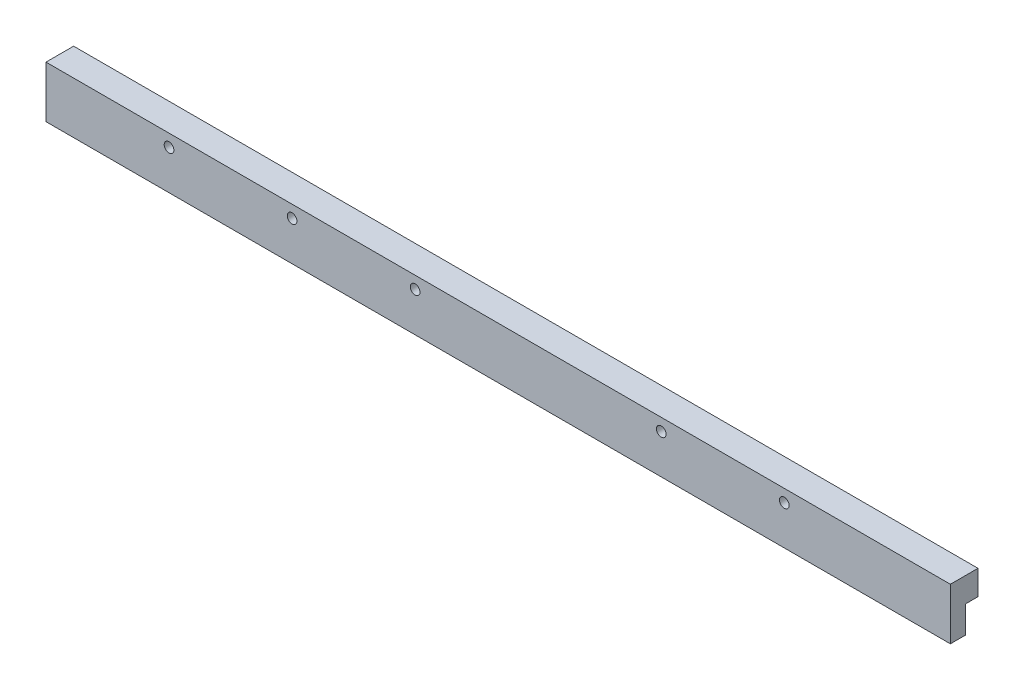
from build123d import *
from build123d.topology import SkipClean

# Parameters (mm, degrees)
BOSS_EXTRUDE1_DEPTH     = 177.8
SKETCH2_R               = 6.35
BOSS_EXTRUDE2_DEPTH     = 3.175
CUT_EXTRUDE1_DEPTH      = 7.62
SKETCH4_R               = 35.56
CUT_EXTRUDE2_DEPTH      = 5.08
BOSS_EXTRUDE3_DEPTH     = 3.175
BOSS_EXTRUDE4_START     = -3.175
BOSS_EXTRUDE4_DEPTH     = 3.175
SKETCH2_3_R             = 6.35
CUT_EXTRUDE3_DEPTH      = 203.2
SKETCH7_W               = 104.303861479
SKETCH7_H               = 17.78
CUT_EXTRUDE4_DEPTH      = 7.62
SKETCH9_W               = 5.09491902
SKETCH9_H               = 10.16
BOSS_EXTRUDE5_DEPTH     = 373.38
SKETCH10_W              = 16.389929124
SKETCH10_H              = 55.852942909
CUT_EXTRUDE5_DEPTH      = 50.8
SKETCH11_W              = 37.311204657
SKETCH11_H              = 70.036499624
CUT_EXTRUDE6_DEPTH      = 63.5
CUT_EXTRUDE_THIN3_DEPTH = 1.27
BOSS_EXTRUDE6_DEPTH     = 1.27
BOSS_EXTRUDE6_2_DEPTH   = 1.27
BOSS_EXTRUDE6_3_DEPTH   = 1.27
BOSS_EXTRUDE6_4_DEPTH   = 1.27
SKETCH14_R              = 6.35
CUT_EXTRUDE7_DEPTH      = 6.35
SKETCH15_R              = 6.35
CUT_EXTRUDE8_DEPTH      = 6.35
SKETCH16_R              = 2
CUT_EXTRUDE9_DEPTH      = 203.2
SKETCH17_R              = 2
CUT_EXTRUDE10_DEPTH     = 50.8
CUT_EXTRUDE11_DEPTH     = 50.8
CUT_EXTRUDE12_DEPTH     = 135.636
SKETCH20_W              = 88.9
SKETCH20_H              = 19.05
CUT_EXTRUDE13_DEPTH     = 25.4
SKETCH22_W              = 88.9
SKETCH22_H              = 19.05
CUT_EXTRUDE14_DEPTH     = 25.4
CUT_EXTRUDE15_DEPTH     = 12.7
SKETCH24_R              = 1.5
CUT_EXTRUDE16_DEPTH     = 12.7
SKETCH25_W              = 262.331886811
SKETCH25_H              = 349.210695903
CUT_EXTRUDE17_DEPTH     = 381


with BuildPart() as part:
    # Sketch1 → Boss-Extrude1 (new body)
    with BuildSketch(Plane.XY):
        Polygon((174.206706958, 205.225588808), (176.700980282, 203.057350086), (6.59291173, 7.37040221), (4.098638405, 9.538640932), align=None)
        Polygon((176.700980282, 203.057350086), (176.700980282, 207.584488047), (174.206706958, 205.225588808), align=None)
        Polygon((176.700980282, 203.057350086), (176.700980282, 207.584488047), (294.86623267, 79.97762329), (292.609334988, 77.887713122), align=None)
        Polygon((176.700980282, 203.057350086), (6.59291173, 7.37040221), (11.706315855, 7.37040221), (176.700980282, 197.43083223), align=None)
        Polygon((292.609334988, 77.887713122), (179.222024463, 200.334870023), (176.700980282, 197.43083223), (289.802992908, 75.306026972), align=None)
        Polygon((179.222024463, 200.334870023), (176.700980282, 203.057350086), (176.700980282, 197.43083223), align=None)
    extrude(amount=BOSS_EXTRUDE1_DEPTH)

    # Sketch2 → Boss-Extrude2 (add)
    with BuildSketch(Plane(origin=(0, 0, 0), x_dir=(-1, 0, 0), z_dir=(0, 0, -1))):
        Polygon((-176.700980282, 207.584488047), (-294.86623267, 79.97762329), (-294.86623267, 308.57762329), (-4.03623267, 308.57762329), (-4.03623267, 9.466851346), align=None)
        with Locations((-109.551832016, 215.6073789)):
            Circle(SKETCH2_R, mode=Mode.SUBTRACT)
        with Locations((-50.099162461, 143.63835786)):
            Circle(SKETCH2_R, mode=Mode.SUBTRACT)
    boss_extrude2 = extrude(amount=-BOSS_EXTRUDE2_DEPTH)

    # Mirror1: Boss-Extrude2 across plane
    add(boss_extrude2.mirror(Plane.XY.offset(88.9)))

    # Sketch3 → Cut-Extrude1 (cut)
    with BuildSketch(Plane(origin=(-2.388376456, 2.076183978, 0), x_dir=(0.6560590289905027, 0.754709580222776, 0), z_dir=(-0.754709580222776, 0.6560590289905027, 0))):
        Polygon((146.938003774, -3.175), (147.021985505, -88.9), (210.43489334, -88.9), (210.43489334, -3.175), align=None)
        Polygon((210.43489334, -88.9), (147.021985505, -88.9), (147.047852426, -115.303859178), (210.43489334, -115.303859178), align=None)
    extrude(amount=-CUT_EXTRUDE1_DEPTH, mode=Mode.SUBTRACT)

    # Sketch4 → Cut-Extrude2 (cut)
    with BuildSketch(Plane.XY.offset(3.175)):
        with Locations((115.138547862, 136.94700246)):
            Circle(SKETCH4_R)
    extrude(amount=-CUT_EXTRUDE2_DEPTH, mode=Mode.SUBTRACT)

    # Sketch5 → Boss-Extrude3 (add)
    with BuildSketch(Plane(origin=(0, 0, 0), x_dir=(-1, 0, 0), z_dir=(0, 0, -1))):
        with BuildLine():
            Line((23.718677813, 87.809342908), (-4.03623267, 87.809342908))
            Line((-4.03623267, 87.809342908), (-4.03623267, 68.97229904))
            ThreePointArc((-4.03623267, 68.97229904), (2.710389506, 69.812621892), (6.35, 64.070123417))
            ThreePointArc((6.35, 64.070123417), (2.710389506, 58.327624943), (-4.03623267, 59.167947795))
            Line((-4.03623267, 59.167947795), (-4.03623267, 41.258157594))
            Line((-4.03623267, 41.258157594), (23.718677813, 41.258157594))
            Line((23.718677813, 41.258157594), (23.718677813, 87.809342908))
        make_face()
    extrude(amount=-BOSS_EXTRUDE3_DEPTH)

    # Sketch6 → Boss-Extrude4 (add)
    with BuildSketch(Plane.XY.offset(177.8).offset(BOSS_EXTRUDE4_START)):
        with BuildLine():
            Line((4.03623267, 68.97229904), (4.03623267, 87.809342908))
            Line((4.03623267, 87.809342908), (-23.718677813, 87.809342908))
            Line((-23.718677813, 87.809342908), (-23.718677813, 41.258157594))
            Line((-23.718677813, 41.258157594), (4.03623267, 41.258157594))
            Line((4.03623267, 41.258157594), (4.03623267, 59.167947795))
            ThreePointArc((4.03623267, 59.167947795), (-6.35, 64.070123417), (4.03623267, 68.97229904))
        make_face()
    extrude(amount=BOSS_EXTRUDE4_DEPTH)

    # Sketch2<3> → Cut-Extrude3 (cut)
    with SkipClean():  # the faces are left unmerged after this step: merging them gives an invalid solid
        with BuildSketch(Plane(origin=(0, 0, 0), x_dir=(-1, 0, 0), z_dir=(0, 0, -1))):
            with Locations((0, 64.070123417)):
                Circle(SKETCH2_3_R)
        extrude(amount=-CUT_EXTRUDE3_DEPTH, mode=Mode.SUBTRACT)

    # Sketch7 → Cut-Extrude4 (cut)
    with SkipClean():  # the faces are left unmerged after this step: merging them gives an invalid solid
        with BuildSketch(Plane(origin=(198.614996443, 183.919503291, 0), x_dir=(0, 0, -1), z_dir=(0.7337298645028701, 0.6794413042615234, 0))):
            with Locations((-88.799310538, -132.772327008)):
                Rectangle(SKETCH7_W, SKETCH7_H)
        extrude(amount=-CUT_EXTRUDE4_DEPTH, mode=Mode.SUBTRACT)

    # Sketch9 → Boss-Extrude5 (add)
    with SkipClean():  # the faces are left unmerged after this step: merging them gives an invalid solid
        with BuildSketch(Plane(origin=(294.86623267, 0, 0), x_dir=(0, 0, -1), z_dir=(1, 0, 0))):
            with Locations((2.54745951, 191.791667894)):
                Rectangle(SKETCH9_W, SKETCH9_H)
            Polygon((5.09491902, 196.871667894), (5.09491902, 186.711667894), (5.09491902, 175.560674011), (11.405822058, 175.560674011), (11.405822058, 196.871667894), align=None)
        boss_extrude5 = extrude(amount=-BOSS_EXTRUDE5_DEPTH)

    # Mirror2: Boss-Extrude5 across plane
    with SkipClean():  # the faces are left unmerged after this step: merging them gives an invalid solid
        add(boss_extrude5.mirror(Plane.XY.offset(88.9)))

    # Sketch10 → Cut-Extrude5 (cut)
    with SkipClean():  # the faces are left unmerged after this step: merging them gives an invalid solid
        with BuildSketch(Plane(origin=(294.86623267, 0, 0), x_dir=(0, 0, -1), z_dir=(1, 0, 0))):
            with Locations((8.194964562, 177.809205996)):
                Rectangle(SKETCH10_W, SKETCH10_H)
        extrude(amount=-CUT_EXTRUDE5_DEPTH, mode=Mode.SUBTRACT)

    # Sketch11 → Cut-Extrude6 (cut)
    with SkipClean():  # the faces are left unmerged after this step: merging them gives an invalid solid
        with BuildSketch(Plane(origin=(0, 0, 0), x_dir=(-1, 0, 0), z_dir=(0, 0, -1))):
            with Locations((-276.210630342, 174.143668429)):
                Rectangle(SKETCH11_W, SKETCH11_H)
        extrude(amount=-CUT_EXTRUDE6_DEPTH, mode=Mode.SUBTRACT)

    # Sketch12 → Cut-Extrude-Thin3 (cut)
    with SkipClean():  # the faces are left unmerged after this step: merging them gives an invalid solid
        with BuildSketch(Plane(origin=(198.614996443, 183.919503291, 0), x_dir=(0, 0, -1), z_dir=(0.7337298645028701, 0.6794413042615234, 0))):
            Polygon((-171.532951818, 28.022585612), (-143.20199229, -115.162103868), (-139.962790584, -114.521185535), (-168.293750113, 28.663503944), align=None)
            Polygon((-33.454545449, -115.162103868), (-6.228065693, 28.022585612), (-9.471942339, 28.639406741), (-36.698422095, -114.545282739), align=None)
        extrude(amount=-CUT_EXTRUDE_THIN3_DEPTH, mode=Mode.SUBTRACT)

    # Sketch14 → Cut-Extrude7 (cut)
    with SkipClean():  # the faces are left unmerged after this step: merging them gives an invalid solid
        with BuildSketch(Plane.XY.offset(3.175)):
            with Locations((25.62623267, 167.726388192)):
                Circle(SKETCH14_R)
        extrude(amount=-CUT_EXTRUDE7_DEPTH, mode=Mode.SUBTRACT)

    # Sketch15 → Cut-Extrude8 (cut)
    with SkipClean():  # the faces are left unmerged after this step: merging them gives an invalid solid
        with BuildSketch(Plane.XY.offset(177.8)):
            with Locations((25.62623267, 167.726388192)):
                Circle(SKETCH15_R)
        extrude(amount=-CUT_EXTRUDE8_DEPTH, mode=Mode.SUBTRACT)

    # Sketch16 → Cut-Extrude9 (cut)
    with SkipClean():  # the faces are left unmerged after this step: merging them gives an invalid solid
        with BuildSketch(Plane(origin=(0, 0, -11.405822058), x_dir=(-1, 0, 0), z_dir=(0, 0, -1))):
            with Locations(Location((-175.48623267, 191.791667894, 0), (0, 0, 90))):
                Circle(SKETCH16_R)
            with Locations(Location((-73.88623267, 191.791667894, 0), (0, 0, 180))):
                Circle(SKETCH16_R)
            with Locations(Location((-23.08623267, 191.791667894, 0), (0, 0, 180))):
                Circle(SKETCH16_R)
            with Locations(Location((27.71376733, 191.791667894, 0), (0, 0, 90))):
                Circle(SKETCH16_R)
        extrude(amount=-CUT_EXTRUDE9_DEPTH, mode=Mode.SUBTRACT)

    # Sketch17 → Cut-Extrude10 (cut)
    with SkipClean():  # the faces are left unmerged after this step: merging them gives an invalid solid
        with BuildSketch(Plane.XY.offset(189.205822058)):
            with Locations((226.28623267, 191.73762329)):
                Circle(SKETCH17_R)
        extrude(amount=-CUT_EXTRUDE10_DEPTH, mode=Mode.SUBTRACT)

    # Sketch18 → Cut-Extrude11 (cut)
    with SkipClean():  # the faces are left unmerged after this step: merging them gives an invalid solid
        with BuildSketch(Plane(origin=(198.614996443, 183.919503291, 0), x_dir=(0, 0, -1), z_dir=(0.7337298645028701, 0.6794413042615234, 0))):
            Polygon((-170.82495725, -33.509501551), (-170.82495725, -115.912858784), (-148.021512482, -115.912858784), (-165.124096058, -33.509501551), align=None)
        extrude(amount=-CUT_EXTRUDE11_DEPTH, mode=Mode.SUBTRACT)

    # Sketch19 → Cut-Extrude12 (cut)
    with SkipClean():  # the faces are left unmerged after this step: merging them gives an invalid solid
        with BuildSketch(Plane(origin=(198.614996443, 183.919503291, 0), x_dir=(0, 0, -1), z_dir=(0.7337298645028701, 0.6794413042615234, 0))):
            Polygon((-27.790980507, -115.912858784), (-12.83560064, -35.35545082), (-7.206169917, -35.35545082), (-7.206169917, -115.912858784), align=None)
        extrude(amount=-CUT_EXTRUDE12_DEPTH, mode=Mode.SUBTRACT)

    # Sketch20 → Cut-Extrude13 (cut)
    with SkipClean():  # the faces are left unmerged after this step: merging them gives an invalid solid
        with BuildSketch(Plane.XY.offset(177.8)):
            with BuildLine():
                Line((162.857920191, 291.02562329), (162.857920191, 292.57562329))
                Line((162.857920191, 292.57562329), (164.407920191, 292.57562329))
                ThreePointArc((164.407920191, 292.57562329), (161.76190468, 293.671638801), (162.857920191, 291.02562329))
            make_face()
            with BuildLine():
                Line((164.407920191, 292.57562329), (162.857920191, 292.57562329))
                Line((162.857920191, 292.57562329), (162.857920191, 291.02562329))
                ThreePointArc((162.857920191, 291.02562329), (163.953935702, 291.479607779), (164.407920191, 292.57562329))
            make_face()
            with BuildLine():
                ThreePointArc((266.007920191, 292.57562329), (264.457920191, 294.12562329), (262.907920191, 292.57562329))
                Line((262.907920191, 292.57562329), (264.457920191, 292.57562329))
                Line((264.457920191, 292.57562329), (264.457920191, 291.02562329))
                ThreePointArc((264.457920191, 291.02562329), (265.553935702, 291.479607779), (266.007920191, 292.57562329))
            make_face()
            with BuildLine():
                Line((264.457920191, 292.57562329), (262.907920191, 292.57562329))
                ThreePointArc((262.907920191, 292.57562329), (263.36190468, 291.479607779), (264.457920191, 291.02562329))
                Line((264.457920191, 291.02562329), (264.457920191, 292.57562329))
            make_face()
            with BuildLine():
                ThreePointArc((164.407920191, 241.77562329), (163.953935702, 242.871638801), (162.857920191, 243.32562329))
                Line((162.857920191, 243.32562329), (162.857920191, 241.77562329))
                Line((162.857920191, 241.77562329), (164.407920191, 241.77562329))
            make_face()
            with BuildLine():
                Line((162.857920191, 241.77562329), (162.857920191, 243.32562329))
                ThreePointArc((162.857920191, 243.32562329), (161.76190468, 240.679607779), (164.407920191, 241.77562329))
                Line((164.407920191, 241.77562329), (162.857920191, 241.77562329))
            make_face()
            with BuildLine():
                ThreePointArc((266.007920191, 241.77562329), (265.553935702, 242.871638801), (264.457920191, 243.32562329))
                Line((264.457920191, 243.32562329), (264.457920191, 241.77562329))
                Line((264.457920191, 241.77562329), (262.907920191, 241.77562329))
                ThreePointArc((262.907920191, 241.77562329), (264.457920191, 240.22562329), (266.007920191, 241.77562329))
            make_face()
            with BuildLine():
                Line((264.457920191, 241.77562329), (264.457920191, 243.32562329))
                ThreePointArc((264.457920191, 243.32562329), (263.36190468, 242.871638801), (262.907920191, 241.77562329))
                Line((262.907920191, 241.77562329), (264.457920191, 241.77562329))
            make_face()
            with Locations((213.657920191, 282.969686208)):
                Rectangle(SKETCH20_W, SKETCH20_H)
        extrude(amount=-CUT_EXTRUDE13_DEPTH, mode=Mode.SUBTRACT)

    # Sketch22 → Cut-Extrude14 (cut)
    with SkipClean():  # the faces are left unmerged after this step: merging them gives an invalid solid
        with BuildSketch(Plane(origin=(0, 0, 0), x_dir=(-1, 0, 0), z_dir=(0, 0, -1))):
            with BuildLine():
                Line((-264.581570713, 291.02562329), (-264.581570713, 292.57562329))
                Line((-264.581570713, 292.57562329), (-263.031570713, 292.57562329))
                ThreePointArc((-263.031570713, 292.57562329), (-265.677586224, 293.671638801), (-264.581570713, 291.02562329))
            make_face()
            with BuildLine():
                Line((-263.031570713, 292.57562329), (-264.581570713, 292.57562329))
                Line((-264.581570713, 292.57562329), (-264.581570713, 291.02562329))
                ThreePointArc((-264.581570713, 291.02562329), (-263.485555202, 291.479607779), (-263.031570713, 292.57562329))
            make_face()
            with BuildLine():
                ThreePointArc((-263.031570713, 241.77562329), (-263.485555202, 242.871638801), (-264.581570713, 243.32562329))
                Line((-264.581570713, 243.32562329), (-264.581570713, 241.77562329))
                Line((-264.581570713, 241.77562329), (-263.031570713, 241.77562329))
            make_face()
            with BuildLine():
                Line((-264.581570713, 241.77562329), (-264.581570713, 243.32562329))
                ThreePointArc((-264.581570713, 243.32562329), (-265.677586224, 240.679607779), (-263.031570713, 241.77562329))
                Line((-263.031570713, 241.77562329), (-264.581570713, 241.77562329))
            make_face()
            with BuildLine():
                ThreePointArc((-161.431570713, 292.57562329), (-162.981570713, 294.12562329), (-164.531570713, 292.57562329))
                Line((-164.531570713, 292.57562329), (-162.981570713, 292.57562329))
                Line((-162.981570713, 292.57562329), (-162.981570713, 291.02562329))
                ThreePointArc((-162.981570713, 291.02562329), (-161.885555202, 291.479607779), (-161.431570713, 292.57562329))
            make_face()
            with BuildLine():
                Line((-162.981570713, 292.57562329), (-164.531570713, 292.57562329))
                ThreePointArc((-164.531570713, 292.57562329), (-164.077586224, 291.479607779), (-162.981570713, 291.02562329))
                Line((-162.981570713, 291.02562329), (-162.981570713, 292.57562329))
            make_face()
            with BuildLine():
                ThreePointArc((-161.431570713, 241.77562329), (-161.885555202, 242.871638801), (-162.981570713, 243.32562329))
                Line((-162.981570713, 243.32562329), (-162.981570713, 241.77562329))
                Line((-162.981570713, 241.77562329), (-164.531570713, 241.77562329))
                ThreePointArc((-164.531570713, 241.77562329), (-162.981570713, 240.22562329), (-161.431570713, 241.77562329))
            make_face()
            with BuildLine():
                Line((-162.981570713, 241.77562329), (-162.981570713, 243.32562329))
                ThreePointArc((-162.981570713, 243.32562329), (-164.077586224, 242.871638801), (-164.531570713, 241.77562329))
                Line((-164.531570713, 241.77562329), (-162.981570713, 241.77562329))
            make_face()
            with Locations((-213.781570713, 283.028383525)):
                Rectangle(SKETCH22_W, SKETCH22_H)
        extrude(amount=-CUT_EXTRUDE14_DEPTH, mode=Mode.SUBTRACT)

    # Sketch23 → Cut-Extrude15 (cut)
    with SkipClean():  # the faces are left unmerged after this step: merging them gives an invalid solid
        with BuildSketch(Plane(origin=(0, 0, 0), x_dir=(-1, 0, 0), z_dir=(0, 0, -1))):
            with BuildLine():
                ThreePointArc((-281.46966057, 89.27791623), (-283.589396682, 89.195947845), (-283.507428297, 87.076211733))
                Line((-283.507428297, 87.076211733), (-281.46966057, 89.27791623))
            make_face()
            with BuildLine():
                Line((-281.46966057, 89.27791623), (-283.507428297, 87.076211733))
                ThreePointArc((-283.507428297, 87.076211733), (-281.887847254, 86.802595758), (-280.988544434, 88.177063981))
                ThreePointArc((-280.988544434, 88.177063981), (-281.11407621, 88.777761162), (-281.46966057, 89.27791623))
            make_face()
            with BuildLine():
                ThreePointArc((-261.677113571, 110.662757672), (-263.796849683, 110.580789287), (-263.714881298, 108.461053175))
                Line((-263.714881298, 108.461053175), (-261.677113571, 110.662757672))
            make_face()
            with BuildLine():
                Line((-261.677113571, 110.662757672), (-263.714881298, 108.461053175))
                ThreePointArc((-263.714881298, 108.461053175), (-262.095300254, 108.1874372), (-261.195997434, 109.561905424))
                ThreePointArc((-261.195997434, 109.561905424), (-261.321529211, 110.162602604), (-261.677113571, 110.662757672))
            make_face()
            with BuildLine():
                ThreePointArc((-242.471013434, 131.413973074), (-244.590749546, 131.332004689), (-244.508781161, 129.212268577))
                Line((-244.508781161, 129.212268577), (-242.471013434, 131.413973074))
            make_face()
            with BuildLine():
                Line((-242.471013434, 131.413973074), (-244.508781161, 129.212268577))
                ThreePointArc((-244.508781161, 129.212268577), (-242.889200117, 128.938652602), (-241.989897298, 130.313120826))
                ThreePointArc((-241.989897298, 130.313120826), (-242.115429074, 130.913818006), (-242.471013434, 131.413973074))
            make_face()
            with BuildLine():
                ThreePointArc((-221.219107983, 154.375577179), (-223.338844094, 154.293608794), (-223.256875709, 152.173872682))
                Line((-223.256875709, 152.173872682), (-221.219107983, 154.375577179))
            make_face()
            with BuildLine():
                Line((-221.219107983, 154.375577179), (-223.256875709, 152.173872682))
                ThreePointArc((-223.256875709, 152.173872682), (-221.637294666, 151.900256707), (-220.737991846, 153.274724931))
                ThreePointArc((-220.737991846, 153.274724931), (-220.863523622, 153.875422111), (-221.219107983, 154.375577179))
            make_face()
            with BuildLine():
                ThreePointArc((-145.886078234, 168.131923716), (-146.764955289, 169.497283115), (-148.371686616, 169.262665118))
                Line((-148.371686616, 169.262665118), (-146.400469852, 167.001182315))
                ThreePointArc((-146.400469852, 167.001182315), (-146.020718836, 167.510800771), (-145.886078234, 168.131923716))
            make_face()
            with BuildLine():
                Line((-146.400469852, 167.001182315), (-148.371686616, 169.262665118))
                ThreePointArc((-148.371686616, 169.262665118), (-148.516819636, 167.146315334), (-146.400469852, 167.001182315))
            make_face()
            with BuildLine():
                ThreePointArc((-49.387047149, 57.423196347), (-50.265924204, 58.788555745), (-51.872655531, 58.553937749))
                Line((-51.872655531, 58.553937749), (-49.901438767, 56.292454945))
                ThreePointArc((-49.901438767, 56.292454945), (-49.521687751, 56.802073401), (-49.387047149, 57.423196347))
            make_face()
            with BuildLine():
                Line((-49.901438767, 56.292454945), (-51.872655531, 58.553937749))
                ThreePointArc((-51.872655531, 58.553937749), (-52.017788551, 56.437587965), (-49.901438767, 56.292454945))
            make_face()
            with BuildLine():
                ThreePointArc((-31.668427664, 37.095470857), (-32.547304719, 38.460830256), (-34.154036046, 38.226212259))
                Line((-34.154036046, 38.226212259), (-32.182819282, 35.964729456))
                ThreePointArc((-32.182819282, 35.964729456), (-31.803068266, 36.474347912), (-31.668427664, 37.095470857))
            make_face()
            with BuildLine():
                Line((-32.182819282, 35.964729456), (-34.154036046, 38.226212259))
                ThreePointArc((-34.154036046, 38.226212259), (-34.299169066, 36.109862475), (-32.182819282, 35.964729456))
            make_face()
            with BuildLine():
                ThreePointArc((-16.066850555, 19.196526928), (-16.94572761, 20.561886326), (-18.552458937, 20.327268329))
                Line((-18.552458937, 20.327268329), (-16.581242173, 18.065785526))
                ThreePointArc((-16.581242173, 18.065785526), (-16.201491157, 18.575403982), (-16.066850555, 19.196526928))
            make_face()
            with BuildLine():
                Line((-16.581242173, 18.065785526), (-18.552458937, 20.327268329))
                ThreePointArc((-18.552458937, 20.327268329), (-18.697591957, 18.210918546), (-16.581242173, 18.065785526))
            make_face()
        extrude(amount=-CUT_EXTRUDE15_DEPTH, mode=Mode.SUBTRACT)

    # Sketch24 → Cut-Extrude16 (cut)
    with SkipClean():  # the faces are left unmerged after this step: merging them gives an invalid solid
        with BuildSketch(Plane.XY.offset(177.8)):
            with Locations((277.221839581, 93.68533948)):
                Circle(SKETCH24_R)
            with Locations((256.088046252, 116.620130178)):
                Circle(SKETCH24_R)
            with Locations((233.352788284, 141.292860476)):
                Circle(SKETCH24_R)
            with Locations((211.758500856, 164.727388047)):
                Circle(SKETCH24_R)
            with Locations((135.020648746, 154.397680008)):
                Circle(SKETCH24_R)
            with Locations((113.672052573, 129.804959434)):
                Circle(SKETCH24_R)
            with Locations((89.546525068, 102.013326118)):
                Circle(SKETCH24_R)
            with Locations((62.67652141, 71.060167118)):
                Circle(SKETCH24_R)
            with Locations((39.522371339, 44.387521375)):
                Circle(SKETCH24_R)
        extrude(amount=-CUT_EXTRUDE16_DEPTH, mode=Mode.SUBTRACT)


with BuildPart() as body_2:
    # Sketch13 → Boss-Extrude6 (new body)
    with BuildSketch(Plane(origin=(198.614996443, 183.919503291, 0), x_dir=(0, 0, -1), z_dir=(0.7337298645028701, 0.6794413042615234, 0))):
        Polygon((-171.532951818, 28.022585612), (-171.375187306, 27.225243654), (-168.293750113, 28.663503944), align=None)
    extrude(amount=-BOSS_EXTRUDE6_DEPTH)


with BuildPart() as body_3:
    # Sketch13 → Boss-Extrude6 2 (new body)
    with BuildSketch(Plane(origin=(198.614996443, 183.919503291, 0), x_dir=(0, 0, -1), z_dir=(0.7337298645028701, 0.6794413042615234, 0))):
        Polygon((-143.20199229, -115.162103868), (-140.120555097, -113.723843577), (-139.962790584, -114.521185535), align=None)
    extrude(amount=-BOSS_EXTRUDE6_2_DEPTH)


with BuildPart() as body_4:
    # Sketch13 → Boss-Extrude6 3 (new body)
    with BuildSketch(Plane(origin=(198.614996443, 183.919503291, 0), x_dir=(0, 0, -1), z_dir=(0.7337298645028701, 0.6794413042615234, 0))):
        Polygon((-9.471942339, 28.639406741), (-6.382619108, 27.209785612), (-6.228065693, 28.022585612), align=None)
    extrude(amount=-BOSS_EXTRUDE6_3_DEPTH)


with BuildPart() as body_5:
    # Sketch13 → Boss-Extrude6 4 (new body)
    with BuildSketch(Plane(origin=(198.614996443, 183.919503291, 0), x_dir=(0, 0, -1), z_dir=(0.7337298645028701, 0.6794413042615234, 0))):
        Polygon((-36.698422095, -114.545282739), (-33.302712556, -114.363611155), (-33.454545449, -115.162103868), align=None)
    extrude(amount=-BOSS_EXTRUDE6_4_DEPTH)


with BuildPart() as cut_extrude17_tool:
    # Sketch25 → Cut-Extrude17 (new body)
    with BuildSketch(Plane(origin=(294.86623267, 0, 0), x_dir=(0, 0, -1), z_dir=(1, 0, 0))):
        with Locations((-46.634056595, 133.972275338)):
            Rectangle(SKETCH25_W, SKETCH25_H)
    extrude(amount=-CUT_EXTRUDE17_DEPTH)


with BuildPart() as part_1:
    add(part.part)

    # Cut-Extrude17: cut by cut_extrude17_tool
    add(cut_extrude17_tool.part, mode=Mode.SUBTRACT)


with BuildPart() as body_2_1:
    add(body_2.part)

    # Cut-Extrude17: cut by cut_extrude17_tool
    add(cut_extrude17_tool.part, mode=Mode.SUBTRACT)


with BuildPart() as body_3_1:
    add(body_3.part)

    # Cut-Extrude17: cut by cut_extrude17_tool
    add(cut_extrude17_tool.part, mode=Mode.SUBTRACT)


with BuildPart() as body_4_1:
    add(body_4.part)

    # Cut-Extrude17: cut by cut_extrude17_tool
    add(cut_extrude17_tool.part, mode=Mode.SUBTRACT)


with BuildPart() as body_5_1:
    add(body_5.part)

    # Cut-Extrude17: cut by cut_extrude17_tool
    add(cut_extrude17_tool.part, mode=Mode.SUBTRACT)


solid = part_1.part
